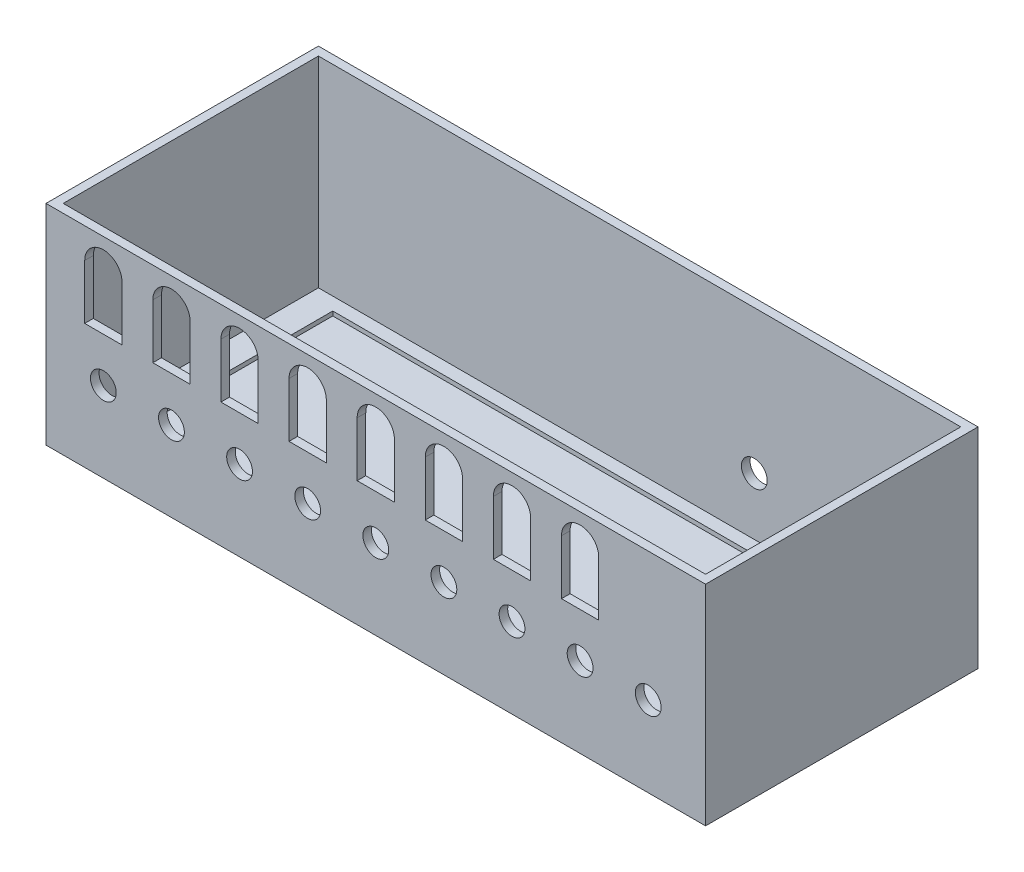
from build123d import *

# Parameters (mm, degrees)
SKETCH1_W           = 230
SKETCH1_H           = 95
BOSS_EXTRUDE1_DEPTH = 3
SKETCH2_W           = 205
SKETCH2_H           = 80
CUT_EXTRUDE1_DEPTH  = 1.5
SKETCH3_W           = 230
SKETCH3_H           = 95
SKETCH3_W_2         = 224
SKETCH3_H_2         = 89
BOSS_EXTRUDE2_DEPTH = 70
SKETCH4_R           = 4.5
CUT_EXTRUDE2_DEPTH  = 3
SKETCH5_R           = 4.5
CUT_EXTRUDE3_DEPTH  = 3


with BuildPart() as part:
    # Sketch1 → Boss-Extrude1 (new body)
    with BuildSketch(Plane(origin=(0, 0, 0), x_dir=(1, 0, 0), z_dir=(0, 1, 0))):
        Rectangle(SKETCH1_W, SKETCH1_H)
    extrude(amount=BOSS_EXTRUDE1_DEPTH)

    # Sketch2 → Cut-Extrude1 (cut)
    with BuildSketch(Plane(origin=(0, 3, 0), x_dir=(1, 0, 0), z_dir=(0, 1, 0))):
        Rectangle(SKETCH2_W, SKETCH2_H)
    extrude(amount=-CUT_EXTRUDE1_DEPTH, mode=Mode.SUBTRACT)

    # Sketch3 → Boss-Extrude2 (add)
    with BuildSketch(Plane(origin=(0, 3, 0), x_dir=(1, 0, 0), z_dir=(0, 1, 0))):
        Rectangle(SKETCH3_W, SKETCH3_H)
        Rectangle(SKETCH3_W_2, SKETCH3_H_2, mode=Mode.SUBTRACT)
    extrude(amount=BOSS_EXTRUDE2_DEPTH)

    # Sketch4 → Cut-Extrude2 (cut)
    with BuildSketch(Plane.XY.offset(47.5)):
        with Locations((95, 28)):
            Circle(SKETCH4_R)
        with Locations((71.25, 28)):
            Circle(SKETCH4_R)
        with Locations((47.5, 28)):
            Circle(SKETCH4_R)
        with Locations((23.75, 28)):
            Circle(SKETCH4_R)
        with Locations((0, 28)):
            Circle(SKETCH4_R)
        with Locations((-23.75, 28)):
            Circle(SKETCH4_R)
        with Locations((-47.5, 28)):
            Circle(SKETCH4_R)
        with Locations((-71.25, 28)):
            Circle(SKETCH4_R)
        with Locations((-95, 28)):
            Circle(SKETCH4_R)
        with BuildLine():
            Line((-101.5, 62.5), (-101.5, 43.5))
            Line((-101.5, 43.5), (-88.5, 43.5))
            Line((-88.5, 43.5), (-88.5, 62.5))
            ThreePointArc((-88.5, 62.5), (-95, 69), (-101.5, 62.5))
        make_face()
        with BuildLine():
            Line((-77.75, 62.5), (-77.75, 43.5))
            Line((-77.75, 43.5), (-64.75, 43.5))
            Line((-64.75, 43.5), (-64.75, 62.5))
            ThreePointArc((-64.75, 62.5), (-71.25, 69), (-77.75, 62.5))
        make_face()
        with BuildLine():
            Line((-54, 62.5), (-54, 43.5))
            Line((-54, 43.5), (-41, 43.5))
            Line((-41, 43.5), (-41, 62.5))
            ThreePointArc((-41, 62.5), (-47.5, 69), (-54, 62.5))
        make_face()
        with BuildLine():
            Line((-30.25, 62.5), (-30.25, 43.5))
            Line((-30.25, 43.5), (-17.25, 43.5))
            Line((-17.25, 43.5), (-17.25, 62.5))
            ThreePointArc((-17.25, 62.5), (-23.75, 69), (-30.25, 62.5))
        make_face()
        with BuildLine():
            Line((-6.5, 62.5), (-6.5, 43.5))
            Line((-6.5, 43.5), (6.5, 43.5))
            Line((6.5, 43.5), (6.5, 62.5))
            ThreePointArc((6.5, 62.5), (0, 69), (-6.5, 62.5))
        make_face()
        with BuildLine():
            Line((17.25, 62.5), (17.25, 43.5))
            Line((17.25, 43.5), (30.25, 43.5))
            Line((30.25, 43.5), (30.25, 62.5))
            ThreePointArc((30.25, 62.5), (23.75, 69), (17.25, 62.5))
        make_face()
        with BuildLine():
            Line((41, 62.5), (41, 43.5))
            Line((41, 43.5), (54, 43.5))
            Line((54, 43.5), (54, 62.5))
            ThreePointArc((54, 62.5), (47.5, 69), (41, 62.5))
        make_face()
        with BuildLine():
            Line((64.75, 62.5), (64.75, 43.5))
            Line((64.75, 43.5), (77.75, 43.5))
            Line((77.75, 43.5), (77.75, 62.5))
            ThreePointArc((77.75, 62.5), (71.25, 69), (64.75, 62.5))
        make_face()
    extrude(amount=-CUT_EXTRUDE2_DEPTH, mode=Mode.SUBTRACT)

    # Sketch5 → Cut-Extrude3 (cut)
    with BuildSketch(Plane(origin=(0, 0, -47.5), x_dir=(-1, 0, 0), z_dir=(0, 0, -1))):
        with Locations((-100, 23)):
            Circle(SKETCH5_R)
        with Locations((-70, 23)):
            Circle(SKETCH5_R)
        with Locations((-40, 23)):
            Circle(SKETCH5_R)
    extrude(amount=-CUT_EXTRUDE3_DEPTH, mode=Mode.SUBTRACT)


solid = part.part
